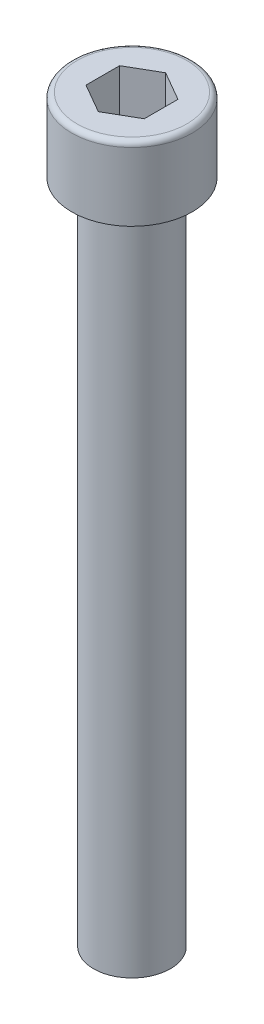
from build123d import *

# Parameters (mm, degrees)
SKETCH1_R           = 1.8288
BOSS_EXTRUDE1_DEPTH = 31.75
SKETCH2_R           = 2.8702
BOSS_EXTRUDE2_DEPTH = 3.5052
FILLET1_R           = 0.254
CUT_EXTRUDE1_DEPTH  = 2.54


with BuildPart() as part:
    # Sketch1 → Boss-Extrude1 (new body)
    with BuildSketch(Plane(origin=(0, 0, 0), x_dir=(1, 0, 0), z_dir=(0, 1, 0))):
        with Locations(Location((0, 0, 0), (0, 0, 270))):
            Circle(SKETCH1_R)
    extrude(amount=-BOSS_EXTRUDE1_DEPTH)

    # Sketch2 → Boss-Extrude2 (add)
    with BuildSketch(Plane(origin=(0, 0, 0), x_dir=(1, 0, 0), z_dir=(0, 1, 0))):
        with Locations(Location((0, 0, 0), (0, 0, 270))):
            Circle(SKETCH2_R)
    extrude(amount=BOSS_EXTRUDE2_DEPTH)

    # Fillet1
    fillet1_edges = [part.edges().sort_by_distance(p)[0] for p in [
        (0, 3.5052, -2.8702),
    ]]
    fillet(fillet1_edges, radius=FILLET1_R)

    # Sketch3 → Cut-Extrude1 (cut)
    with BuildSketch(Plane(origin=(0, 3.5052, 0), x_dir=(1, 0, 0), z_dir=(0, 1, 0))):
        Polygon((0, 1.603951217), (-1.3890625, 0.801975608), (-1.3890625, -0.801975608), (0, -1.603951217), (1.3890625, -0.801975608), (1.3890625, 0.801975608), align=None)
    extrude(amount=-CUT_EXTRUDE1_DEPTH, mode=Mode.SUBTRACT)


solid = part.part
